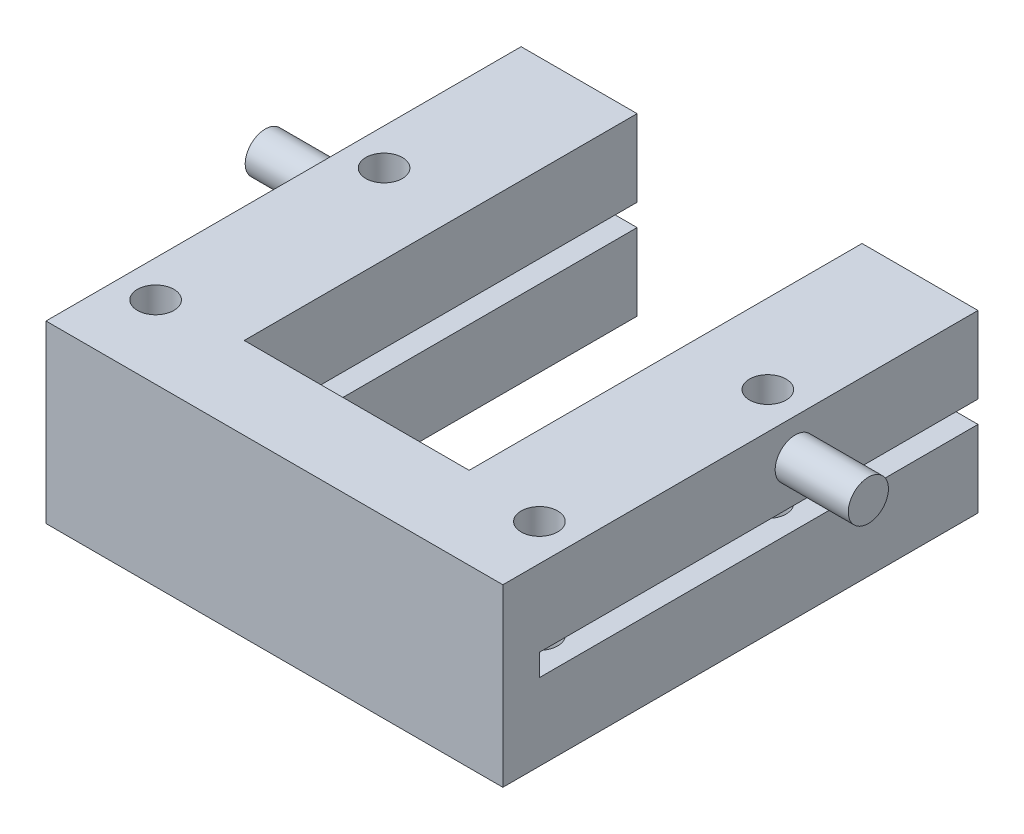
from build123d import *

# Parameters (mm, degrees)
SKETCH1_R           = 1
BOSS_EXTRUDE1_DEPTH = 4.2
SKETCH2_R           = 1.1
BOSS_EXTRUDE2_DEPTH = 4
SKETCH3_W           = 25
SKETCH3_H           = 4.2
BOSS_EXTRUDE3_DEPTH = 2
SKETCH4_W           = 25
SKETCH4_H           = 2
BOSS_EXTRUDE4_DEPTH = 0.6
BOSS_EXTRUDE5_START = -5.4
SKETCH1_3_R         = 1
BOSS_EXTRUDE5_DEPTH = 5.4
SKETCH4_2_W         = 25
SKETCH4_2_H         = 2
BOSS_EXTRUDE6_DEPTH = 5.4
CUT_EXTRUDE2_REACH  = 38.502
SKETCH5_W           = 25
SKETCH5_H           = 1.2
SKETCH6_W           = 2.096367106
SKETCH6_H           = 4.2
BOSS_EXTRUDE8_DEPTH = 21.5
SKETCH5_2_W         = 25
SKETCH5_2_H         = 1.2
CUT_EXTRUDE4_DEPTH  = 2.5


with BuildPart() as part:
    # Sketch1 → Boss-Extrude1 (new body)
    with BuildSketch(Plane(origin=(0, 0, 0), x_dir=(1, 0, 0), z_dir=(0, 1, 0))):
        Polygon((0, 0), (25, 0), (25, 24), (20.75, 24), (20.75, 2.5), (4.25, 2.5), (4.25, 24), (0, 24), align=None)
        with Locations(Location((2, 14.5, 0), (0, 0, 270))):
            Circle(SKETCH1_R, mode=Mode.SUBTRACT)
        with Locations(Location((2, 2, 0), (0, 0, 270))):
            Circle(SKETCH1_R, mode=Mode.SUBTRACT)
        with Locations(Location((23, 2, 0), (0, 0, 90))):
            Circle(SKETCH1_R, mode=Mode.SUBTRACT)
        with Locations(Location((23, 14.5, 0), (0, 0, 90))):
            Circle(SKETCH1_R, mode=Mode.SUBTRACT)
    extrude(amount=BOSS_EXTRUDE1_DEPTH)

    # Sketch2 → Boss-Extrude2 (add)
    with BuildSketch(Plane.ZY):
        with Locations((-14, 2.2)):
            Circle(SKETCH2_R)
    boss_extrude2 = extrude(amount=BOSS_EXTRUDE2_DEPTH)

    # Mirror1: Boss-Extrude2 across plane
    add(boss_extrude2.mirror(Plane.ZY.offset(-12.5)))

    # Sketch3 → Boss-Extrude3 (add)
    with BuildSketch(Plane.XY):
        with Locations((12.5, 2.1)):
            Rectangle(SKETCH3_W, SKETCH3_H)
    extrude(amount=BOSS_EXTRUDE3_DEPTH)

    # Sketch4 → Boss-Extrude4 (add)
    with BuildSketch(Plane.XZ):
        with Locations((12.5, 1)):
            Rectangle(SKETCH4_W, SKETCH4_H)
    extrude(amount=BOSS_EXTRUDE4_DEPTH)

    # Sketch1<3> → Boss-Extrude5 (add)
    with BuildSketch(Plane(origin=(0, 0, 0), x_dir=(1, 0, 0), z_dir=(0, 1, 0)).offset(BOSS_EXTRUDE5_START)):
        Polygon((0, 0), (25, 0), (25, 24), (20.75, 24), (20.75, 2.5), (4.25, 2.5), (4.25, 24), (0, 24), align=None)
        with Locations(Location((2, 14.5, 0), (0, 0, 270))):
            Circle(SKETCH1_3_R, mode=Mode.SUBTRACT)
        with Locations(Location((2, 2, 0), (0, 0, 270))):
            Circle(SKETCH1_3_R, mode=Mode.SUBTRACT)
        with Locations(Location((23, 2, 0), (0, 0, 90))):
            Circle(SKETCH1_3_R, mode=Mode.SUBTRACT)
        with Locations(Location((23, 14.5, 0), (0, 0, 90))):
            Circle(SKETCH1_3_R, mode=Mode.SUBTRACT)
    extrude(amount=BOSS_EXTRUDE5_DEPTH)

    # Sketch4<2> → Boss-Extrude6 (add)
    with BuildSketch(Plane.XZ):
        with Locations((12.5, 1)):
            Rectangle(SKETCH4_2_W, SKETCH4_2_H)
    extrude(amount=BOSS_EXTRUDE6_DEPTH)

    # Cut-Extrude2: up to this face of the body (flat: up to its plane)
    cut_extrude2_end = Plane(part.part.faces().sort_by_distance((22.875, -0.6, -24))[0])
    # Sketch5 → Cut-Extrude2 (cut, up to the picked face)
    with BuildSketch(Plane(origin=(0, 0, -2.5), x_dir=(-1, 0, 0), z_dir=(0, 0, -1)), mode=Mode.PRIVATE) as cut_extrude2_sk1:
        with Locations((-12.5, -0.6)):
            Rectangle(SKETCH5_W, SKETCH5_H)
    cut_extrude2_tool1 = split(extrude(cut_extrude2_sk1.sketch, amount=CUT_EXTRUDE2_REACH, mode=Mode.PRIVATE), bisect_by=cut_extrude2_end, keep=Keep.BOTH, mode=Mode.PRIVATE)
    add(cut_extrude2_tool1.solids().sort_by(Axis((12.5, -0.6, -2.5), (0, 0, -1)))[0], mode=Mode.SUBTRACT)

    # Sketch6 → Boss-Extrude8 (add)
    with BuildSketch(Plane(origin=(0, 0, -2.5), x_dir=(-1, 0, 0), z_dir=(0, 0, -1))):
        with Locations((-19.701816447, 2.1)):
            Rectangle(SKETCH6_W, SKETCH6_H)
        with Locations((-5.298183553, 2.1)):
            Rectangle(SKETCH6_W, SKETCH6_H)
        with Locations((-5.298183553, -3.3)):
            Rectangle(SKETCH6_W, SKETCH6_H)
        with Locations((-19.701816447, -3.3)):
            Rectangle(SKETCH6_W, SKETCH6_H)
    extrude(amount=BOSS_EXTRUDE8_DEPTH)

    # Sketch5<2> → Cut-Extrude4 (cut)
    with BuildSketch(Plane(origin=(0, 0, -2.5), x_dir=(-1, 0, 0), z_dir=(0, 0, -1))):
        with Locations((-12.5, -0.6)):
            Rectangle(SKETCH5_2_W, SKETCH5_2_H)
    extrude(amount=-CUT_EXTRUDE4_DEPTH, mode=Mode.SUBTRACT)


solid = part.part
